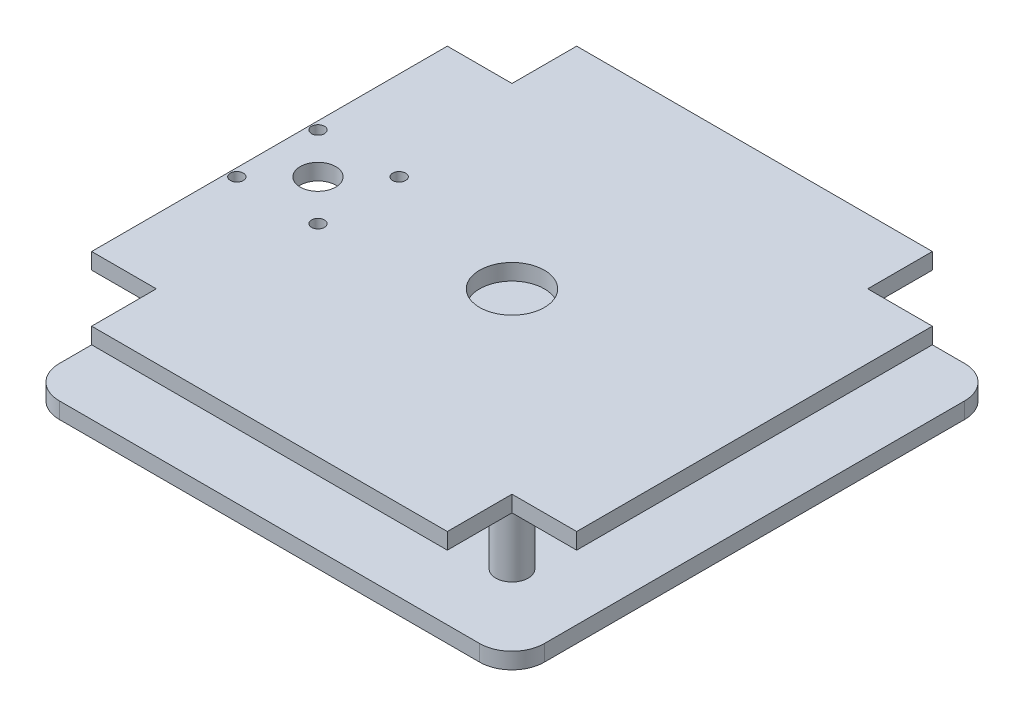
from build123d import *

# Parameters (mm, degrees)
SKETCH2_W           = 150
SKETCH2_H           = 150
BOSS_EXTRUDE1_DEPTH = 5
SKETCH3_R           = 5
BOSS_EXTRUDE2_DEPTH = 20
SKETCH4_R           = 10
CUT_EXTRUDE1_DEPTH  = 108.935165725
SKETCH5_R           = 5.5
CUT_EXTRUDE2_DEPTH  = 20
FILLET1_R           = 10
BOSS_EXTRUDE3_START = 5
BOSS_EXTRUDE3_DEPTH = 5
CUT_EXTRUDE3_START  = -5
SKETCH8_R           = 10
SKETCH8_R_2         = 5.5
CUT_EXTRUDE3_DEPTH  = 5
SKETCH9_R           = 2
SKETCH9_R_2         = 5.5
CUT_EXTRUDE4_DEPTH  = 5
SKETCH10_W          = 20
SKETCH10_H          = 20
CUT_EXTRUDE5_DEPTH  = 10


with BuildPart() as part:
    # Sketch2 → Boss-Extrude1 (new body)
    with BuildSketch(Plane(origin=(0, 0, 0), x_dir=(1, 0, 0), z_dir=(0, 1, 0))):
        Rectangle(SKETCH2_W, SKETCH2_H)
    extrude(amount=BOSS_EXTRUDE1_DEPTH)

    # Sketch3 → Boss-Extrude2 (add)
    with BuildSketch(Plane(origin=(0, 5, 0), x_dir=(1, 0, 0), z_dir=(0, 1, 0))):
        with Locations((50, 50)):
            Circle(SKETCH3_R)
        with Locations((50, -50)):
            Circle(SKETCH3_R)
        with Locations((-50, -50)):
            Circle(SKETCH3_R)
        with Locations((-50, 50)):
            Circle(SKETCH3_R)
    extrude(amount=BOSS_EXTRUDE2_DEPTH)

    # Sketch4 → Cut-Extrude1 (cut, through all)
    with BuildSketch(Plane(origin=(0, 5, 0), x_dir=(1, 0, 0), z_dir=(0, 1, 0))):
        Circle(SKETCH4_R)
    extrude(amount=-CUT_EXTRUDE1_DEPTH, mode=Mode.SUBTRACT)

    # Sketch5 → Cut-Extrude2 (cut)
    with BuildSketch(Plane(origin=(0, 5, 0), x_dir=(1, 0, 0), z_dir=(0, 1, 0))):
        with Locations((-60, 0)):
            Circle(SKETCH5_R)
    extrude(amount=-CUT_EXTRUDE2_DEPTH, mode=Mode.SUBTRACT)

    # Fillet1
    fillet1_edges = [part.edges().sort_by_distance(p)[0] for p in [
        (-75, 2.5, 75),
        (75, 2.5, 75),
        (75, 2.5, -75),
        (-75, 2.5, -75),
    ]]
    fillet(fillet1_edges, radius=FILLET1_R)

    # Sketch6 → Boss-Extrude3 (add)
    with BuildSketch(Plane(origin=(0, 25, 0), x_dir=(1, 0, 0), z_dir=(0, 1, 0)).offset(BOSS_EXTRUDE3_START)):
        with BuildLine():
            ThreePointArc((-65, 75), (-72.071067812, 72.071067812), (-75, 65))
            Line((-75, 65), (-75, -65))
            ThreePointArc((-75, -65), (-72.071067812, -72.071067812), (-65, -75))
            Line((-65, -75), (65, -75))
            ThreePointArc((65, -75), (72.071067812, -72.071067812), (75, -65))
            Line((75, -65), (75, 65))
            ThreePointArc((75, 65), (72.071067812, 72.071067812), (65, 75))
            Line((65, 75), (-65, 75))
        make_face()
    extrude(amount=-BOSS_EXTRUDE3_DEPTH)

    # Sketch8 → Cut-Extrude3 (cut)
    with BuildSketch(Plane.XZ.offset(-25).offset(CUT_EXTRUDE3_START)):
        Circle(SKETCH8_R)
        with Locations((-60, 0)):
            Circle(SKETCH8_R_2)
    extrude(amount=CUT_EXTRUDE3_DEPTH, mode=Mode.SUBTRACT)

    # Sketch9 → Cut-Extrude4 (cut)
    with BuildSketch(Plane(origin=(0, 30, 0), x_dir=(1, 0, 0), z_dir=(0, 1, 0))):
        with Locations((-47.448854634, 12.551145366)):
            Circle(SKETCH9_R)
        with Locations((-60, 0)):
            Circle(SKETCH9_R_2)
        with Locations((-47.448854634, -12.551145366)):
            Circle(SKETCH9_R)
        with Locations((-72.551145366, -12.551145366)):
            Circle(SKETCH9_R)
        with Locations((-72.551145366, 12.551145366)):
            Circle(SKETCH9_R)
    extrude(amount=-CUT_EXTRUDE4_DEPTH, mode=Mode.SUBTRACT)

    # Sketch10 → Cut-Extrude5 (cut)
    with BuildSketch(Plane(origin=(0, 30, 0), x_dir=(1, 0, 0), z_dir=(0, 1, 0))):
        with Locations((-65, 65)):
            Rectangle(SKETCH10_W, SKETCH10_H)
        with Locations((65, 65)):
            Rectangle(SKETCH10_W, SKETCH10_H)
        with Locations((65, -65)):
            Rectangle(SKETCH10_W, SKETCH10_H)
        with Locations((-65, -65)):
            Rectangle(SKETCH10_W, SKETCH10_H)
    extrude(amount=-CUT_EXTRUDE5_DEPTH, mode=Mode.SUBTRACT)


solid = part.part
